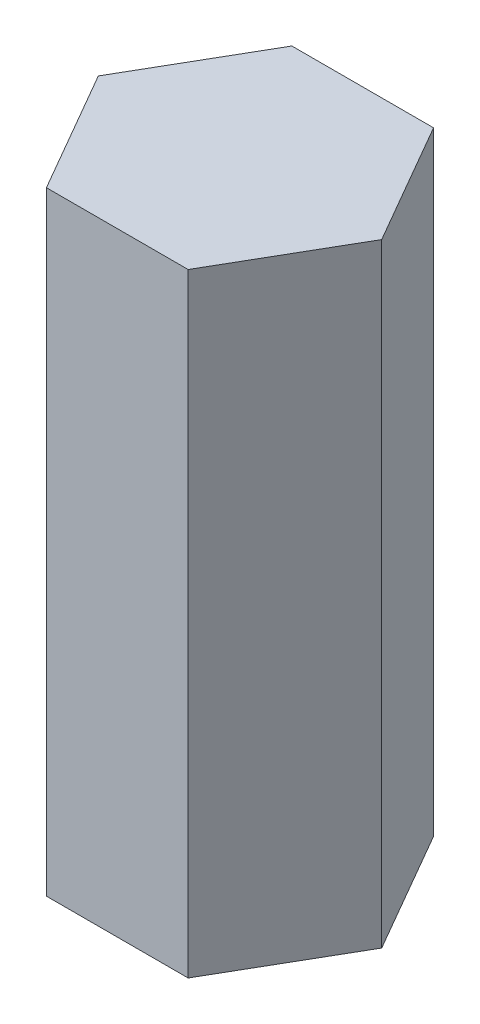
from build123d import *

# Parameters (mm, degrees)
BOSS_EXTRUDE1_DEPTH = 15


with BuildPart() as part:
    # Sketch1 → Boss-Extrude1 (new body)
    with BuildSketch(Plane(origin=(0, 0, 0), x_dir=(1, 0, 0), z_dir=(0, 1, 0))):
        Polygon((1.732050808, 3), (-1.732050808, 3), (-3.464101615, 0), (-1.732050808, -3), (1.732050808, -3), (3.464101615, 0), align=None)
    extrude(amount=BOSS_EXTRUDE1_DEPTH)


solid = part.part
